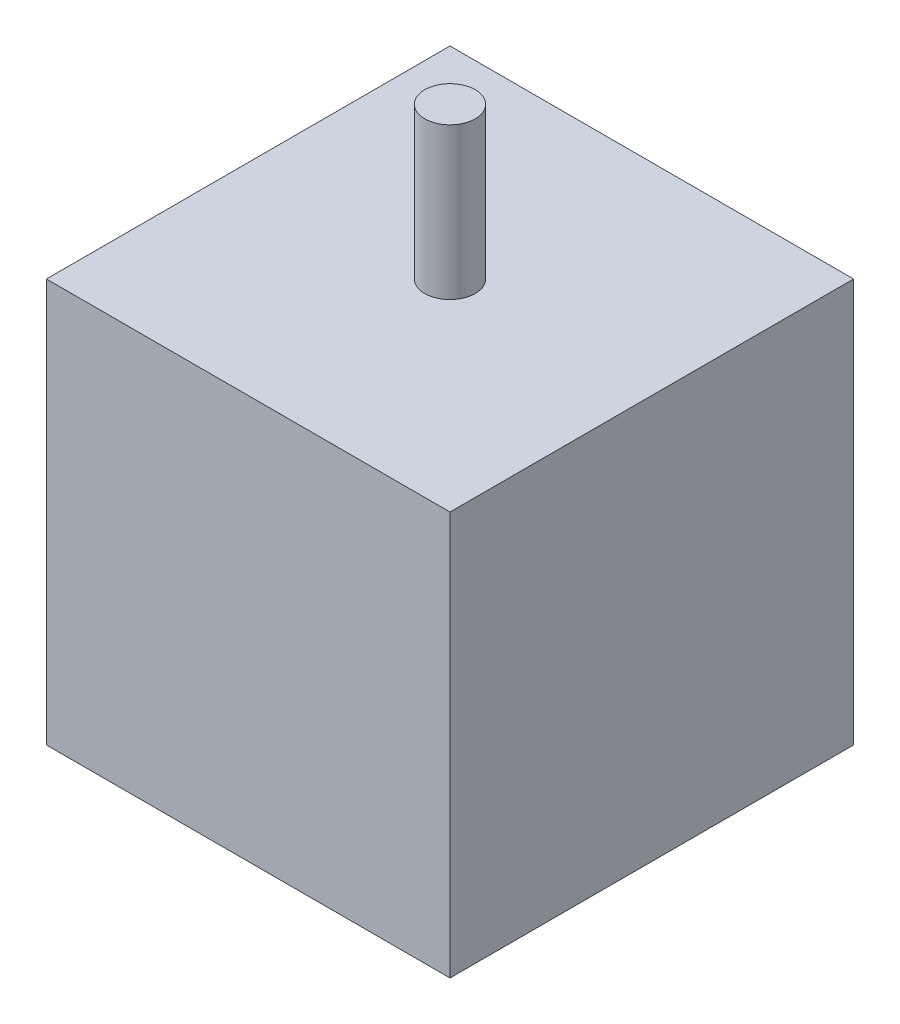
from build123d import *

# Parameters (mm, degrees)
SKETCH1_W           = 101.6
SKETCH1_H           = 101.6
BOSS_EXTRUDE1_DEPTH = 101.6
SKETCH2_R           = 6.35
BOSS_EXTRUDE2_DEPTH = 38.1


with BuildPart() as part:
    # Sketch1 → Boss-Extrude1 (new body)
    with BuildSketch(Plane(origin=(0, 0, 0), x_dir=(1, 0, 0), z_dir=(0, 1, 0))):
        with Locations((50.8, 50.8)):
            Rectangle(SKETCH1_W, SKETCH1_H)
    extrude(amount=BOSS_EXTRUDE1_DEPTH)

    # Sketch2 → Boss-Extrude2 (add)
    with BuildSketch(Plane(origin=(0, 101.6, 0), x_dir=(1, 0, 0), z_dir=(0, 1, 0))):
        with Locations(Location((50.8, 50.8, 0), (0, 0, 90))):
            Circle(SKETCH2_R)
    extrude(amount=BOSS_EXTRUDE2_DEPTH)


solid = part.part
